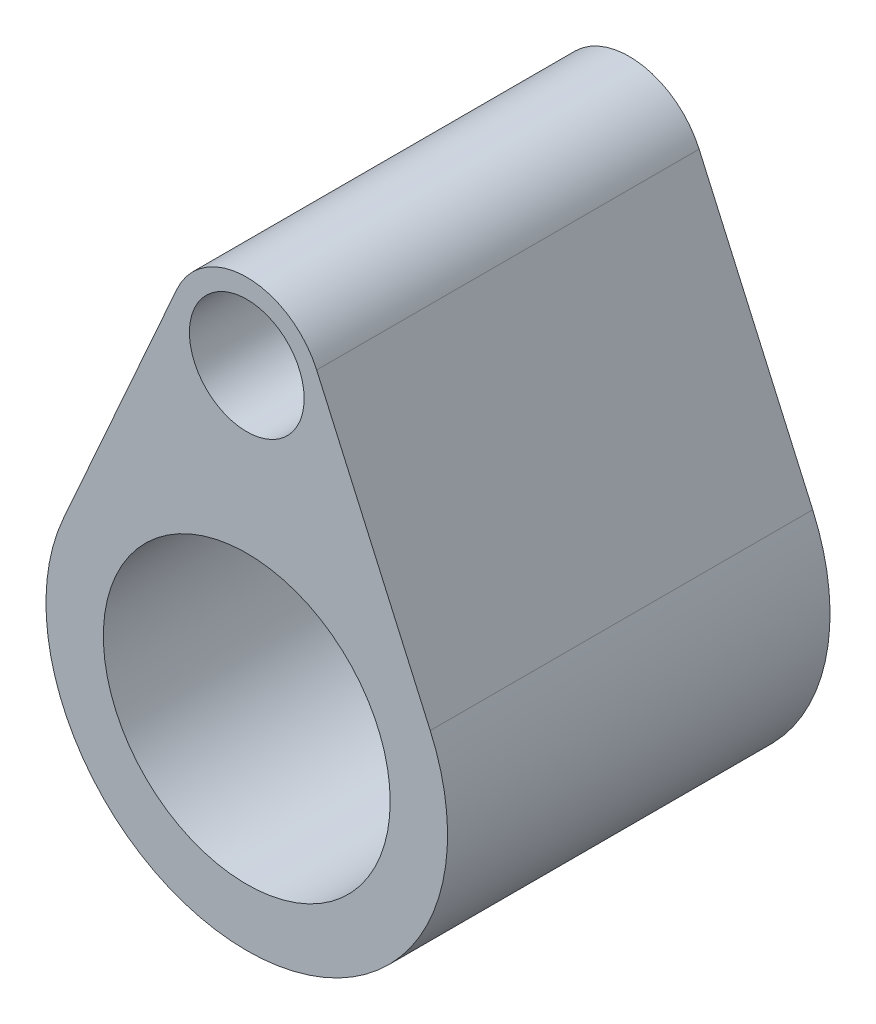
from build123d import *

# Parameters (mm, degrees)
SKETCH1_R           = 75
BOSS_EXTRUDE1_DEPTH = 100
SKETCH3_R           = 30
CUT_EXTRUDE2_DEPTH  = 349.20970693


with BuildPart() as part:
    # Sketch1 → Boss-Extrude1 (new, symmetric)
    with BuildSketch(Plane.XY):
        with BuildLine():
            Line((-95.945006832, -117.34375), (-36.550478793, 16.25))
            ThreePointArc((-36.550478793, 16.25), (0, 40), (36.550478793, 16.25))
            Line((36.550478793, 16.25), (95.945006832, -117.34375))
            ThreePointArc((95.945006832, -117.34375), (0, -265), (-95.945006832, -117.34375))
        make_face()
        with Locations((0, -160)):
            Circle(SKETCH1_R, mode=Mode.SUBTRACT)
    extrude(amount=BOSS_EXTRUDE1_DEPTH, both=True)

    # Sketch3 → Cut-Extrude2 (cut, through all)
    with BuildSketch(Plane.XY.offset(100)):
        Circle(SKETCH3_R)
    extrude(amount=-CUT_EXTRUDE2_DEPTH, mode=Mode.SUBTRACT)


solid = part.part
